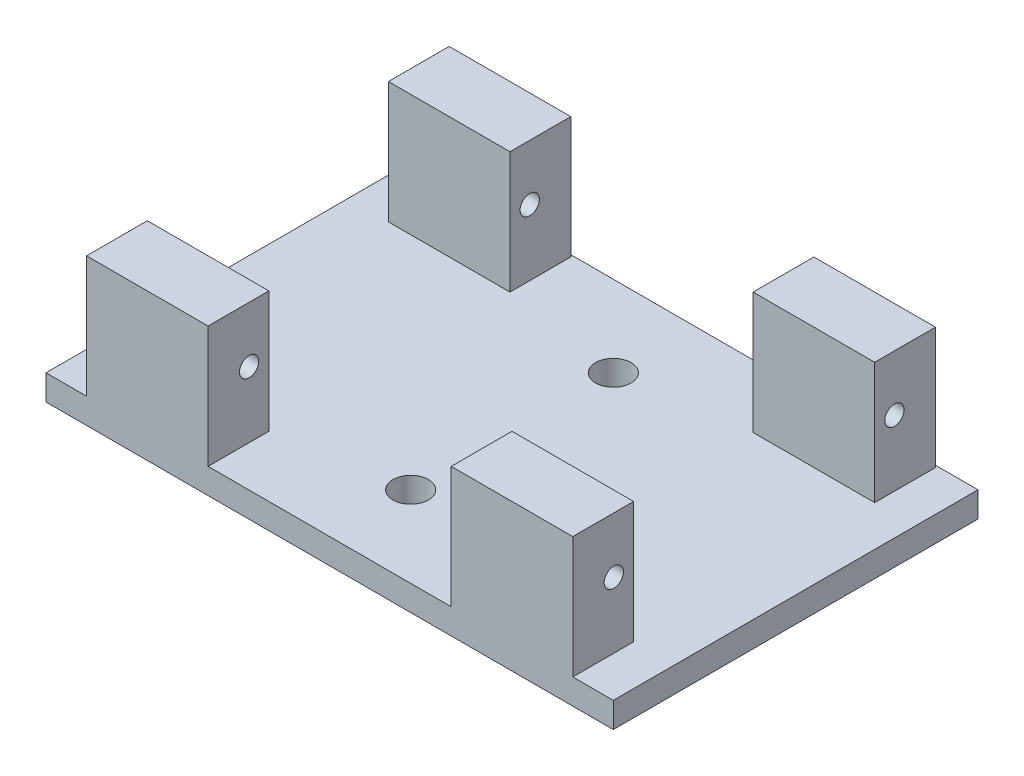
from build123d import *

# Parameters (mm, degrees)
SKETCH_1_W          = 56
SKETCH_1_H          = 36
EXTRUDE_1_DEPTH     = 2.5
SKETCH_2_W          = 12
SKETCH_2_H          = 6
EXTRUDE_2_DEPTH     = 12
SKETCH_3_R          = 0.95
CUT_EXTRUDE_1_DEPTH = 57.905623624
SKETCH_4_R          = 1.75
CUT_EXTRUDE_2_DEPTH = 36.383612026


with BuildPart() as part:
    # 草图1 → 凸台-拉伸1 (new body)
    with BuildSketch(Plane(origin=(0, 0, 0), x_dir=(1, 0, 0), z_dir=(0, 1, 0))):
        Rectangle(SKETCH_1_W, SKETCH_1_H)
    extrude(amount=EXTRUDE_1_DEPTH)

    # 草图2 → 凸台-拉伸2 (add)
    with BuildSketch(Plane(origin=(0, 2.5, 0), x_dir=(1, 0, 0), z_dir=(0, 1, 0))):
        with Locations((18, 14.8)):
            Rectangle(SKETCH_2_W, SKETCH_2_H)
        with Locations((18, -15)):
            Rectangle(SKETCH_2_W, SKETCH_2_H)
    extrude_2 = extrude(amount=EXTRUDE_2_DEPTH)

    # 草图3 → 切除-拉伸1 (cut, through all)
    with BuildSketch(Plane(origin=(24, 0, 0), x_dir=(0, 0, -1), z_dir=(1, 0, 0))):
        with Locations((-13.95, 9)):
            Circle(SKETCH_3_R)
        with Locations((13.75, 9)):
            Circle(SKETCH_3_R)
    cut_extrude_1 = extrude(amount=-CUT_EXTRUDE_1_DEPTH, mode=Mode.SUBTRACT)

    # 镜向1: 凸台-拉伸2, 切除-拉伸1 across plane
    add(extrude_2.mirror(Plane(origin=(0, 0, 0), x_dir=(0, 0, 1), z_dir=(1, 0, 0))))
    add(cut_extrude_1.mirror(Plane(origin=(0, 0, 0), x_dir=(0, 0, 1), z_dir=(1, 0, 0))), mode=Mode.SUBTRACT)

    # 草图4 → 切除-拉伸2 (cut, through all)
    with BuildSketch(Plane(origin=(0, 2.5, 0), x_dir=(1, 0, 0), z_dir=(0, 1, 0))):
        with Locations(Location((0, -10, 0), (0, 0, 270))):
            Circle(SKETCH_4_R)
        with Locations(Location((0, 10, 0), (0, 0, 270))):
            Circle(SKETCH_4_R)
    extrude(amount=-CUT_EXTRUDE_2_DEPTH, mode=Mode.SUBTRACT)


solid = part.part
